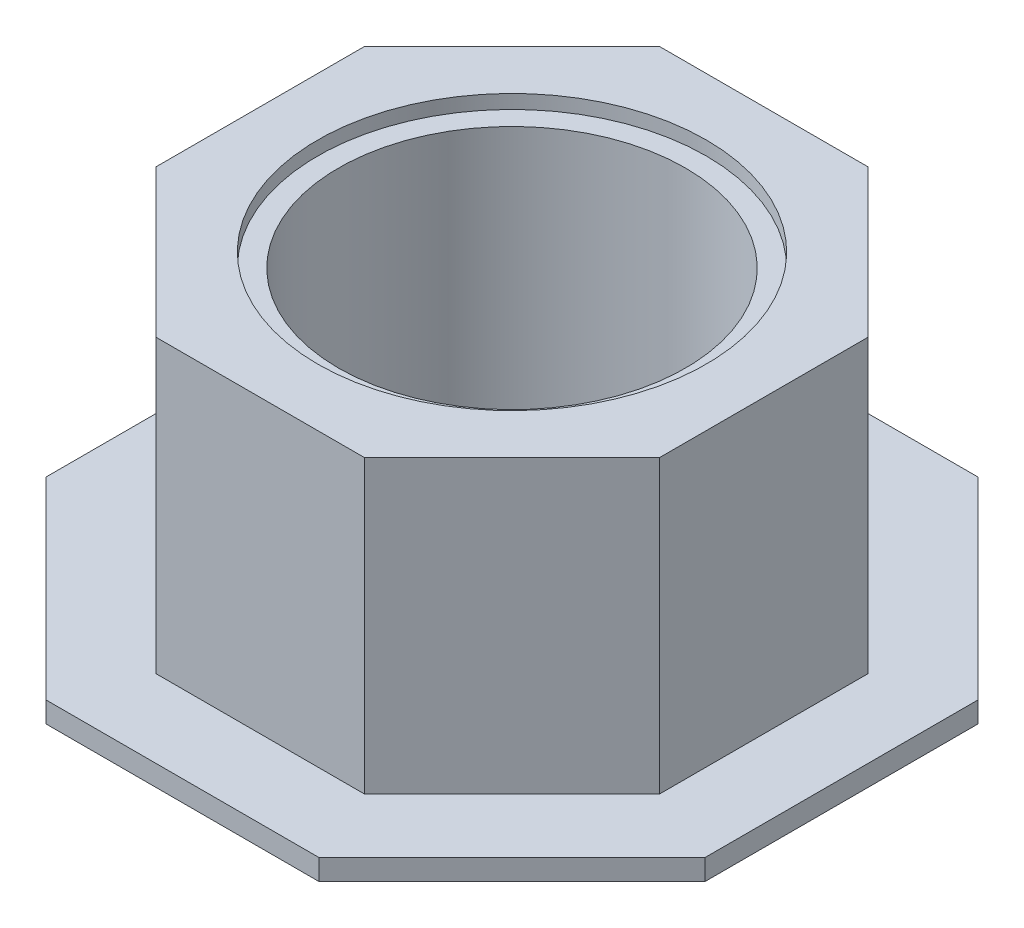
from build123d import *

# Parameters (mm, degrees)
BOSS_EXTRUDE7_DEPTH = 6
SKETCH1_R           = 50
BOSS_EXTRUDE8_DEPTH = 84
CUT_EXTRUDE1_START  = -4
SKETCH4_R           = 56
SKETCH4_R_2         = 50
CUT_EXTRUDE1_DEPTH  = 4


with BuildPart() as part:
    # Sketch2 → Boss-Extrude7 (new body)
    with BuildSketch(Plane(origin=(0, 0, 0), x_dir=(1, 0, 0), z_dir=(0, 1, 0))):
        Polygon((39.35, -94.999303679), (94.999303679, -39.35), (94.999303679, 39.35), (39.35, 94.999303679), (-39.35, 94.999303679), (-94.999303679, 39.35), (-94.999303679, -39.35), (-39.35, -94.999303679), align=None)
    extrude(amount=-BOSS_EXTRUDE7_DEPTH)

    # Sketch1 → Boss-Extrude8 (add)
    with BuildSketch(Plane(origin=(0, 0, 0), x_dir=(1, 0, 0), z_dir=(0, 1, 0))):
        Polygon((-72.59, -30.067762493), (-30.067762493, -72.59), (30.067762493, -72.59), (72.59, -30.067762493), (72.59, 30.067762493), (30.067762493, 72.59), (-30.067762493, 72.59), (-72.59, 30.067762493), align=None)
        with Locations(Location((0, 0, 0), (0, 0, 90))):
            Circle(SKETCH1_R, mode=Mode.SUBTRACT)
    extrude(amount=BOSS_EXTRUDE8_DEPTH)

    # Sketch4 → Cut-Extrude1 (cut)
    with BuildSketch(Plane(origin=(0, 84, 0), x_dir=(1, 0, 0), z_dir=(0, 1, 0)).offset(CUT_EXTRUDE1_START)):
        with Locations(Location((0, 0, 0), (0, 0, 270))):
            Circle(SKETCH4_R)
        with Locations(Location((0, 0, 0), (0, 0, 90))):
            Circle(SKETCH4_R_2, mode=Mode.SUBTRACT)
    extrude(amount=CUT_EXTRUDE1_DEPTH, mode=Mode.SUBTRACT)


solid = part.part
